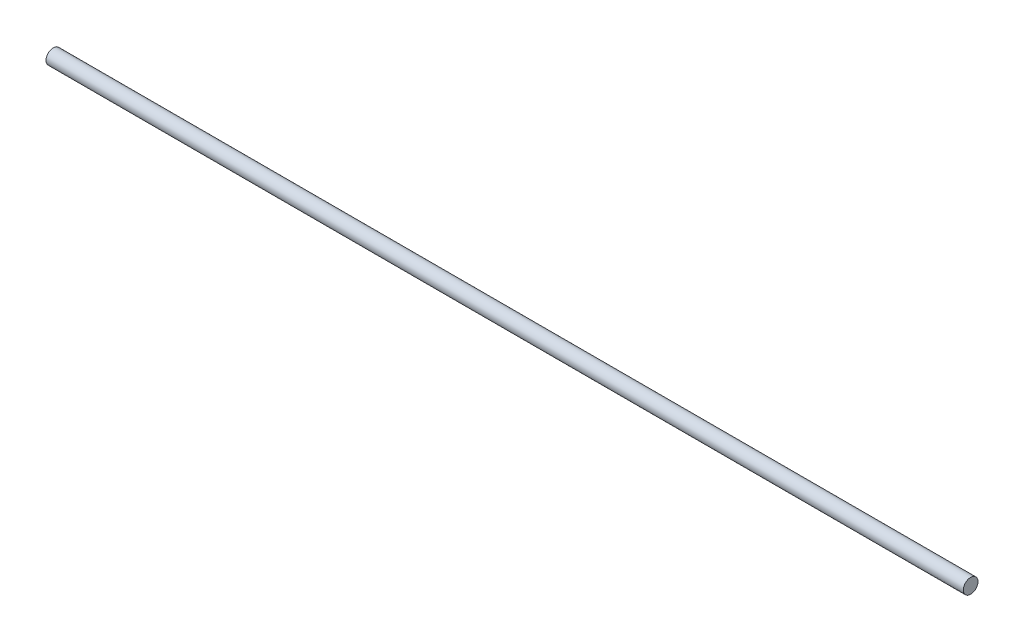
from build123d import *

# Parameters (mm, degrees)
SKETCH1_R           = 6
BOSS_EXTRUDE1_DEPTH = 750


with BuildPart() as part:
    # Sketch1 → Boss-Extrude1 (new body)
    with BuildSketch(Plane(origin=(0, 0, 0), x_dir=(0, 0, -1), z_dir=(1, 0, 0))):
        Circle(SKETCH1_R)
    extrude(amount=BOSS_EXTRUDE1_DEPTH)


solid = part.part
